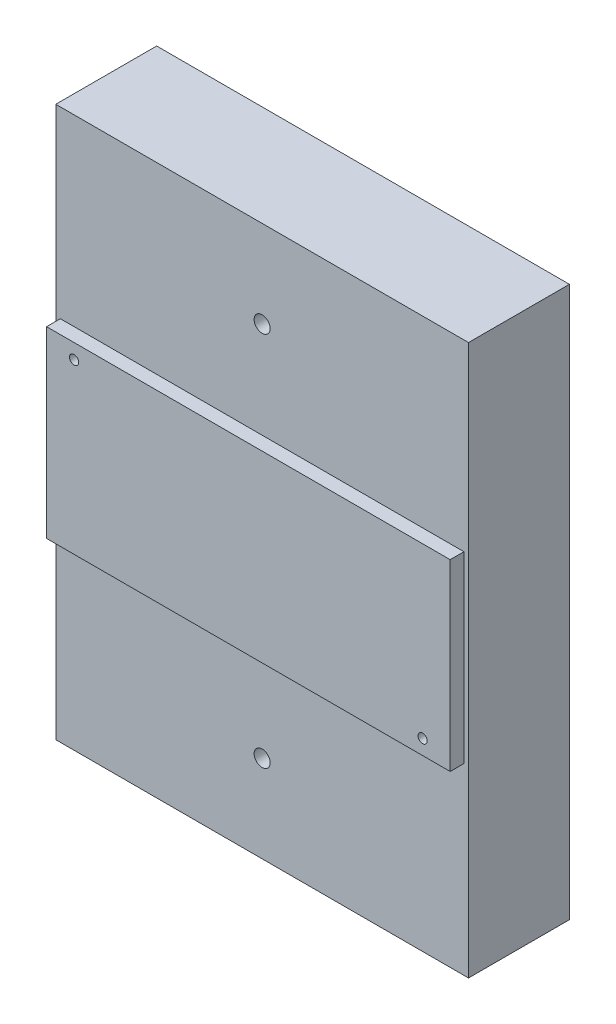
from build123d import *

# Parameters (mm, degrees)
SKETCH1_W           = 90
SKETCH1_H           = 120
SKETCH1_R           = 1.75
BOSS_EXTRUDE1_DEPTH = 22
SKETCH3_W           = 88
SKETCH3_H           = 40
SKETCH3_R           = 1
BOSS_EXTRUDE2_DEPTH = 25


with BuildPart() as part:
    # Sketch1 → Boss-Extrude1 (new body)
    with BuildSketch(Plane.XY):
        Rectangle(SKETCH1_W, SKETCH1_H)
        with Locations((0, 41)):
            Circle(SKETCH1_R, mode=Mode.SUBTRACT)
        with Locations((0, -41)):
            Circle(SKETCH1_R, mode=Mode.SUBTRACT)
    extrude(amount=BOSS_EXTRUDE1_DEPTH)

    # Sketch3 → Boss-Extrude2 (add)
    with BuildSketch(Plane.XY):
        Rectangle(SKETCH3_W, SKETCH3_H)
        with Locations((-38, 16.75)):
            Circle(SKETCH3_R, mode=Mode.SUBTRACT)
        with Locations((38, -16.75)):
            Circle(SKETCH3_R, mode=Mode.SUBTRACT)
    extrude(amount=BOSS_EXTRUDE2_DEPTH)


solid = part.part
